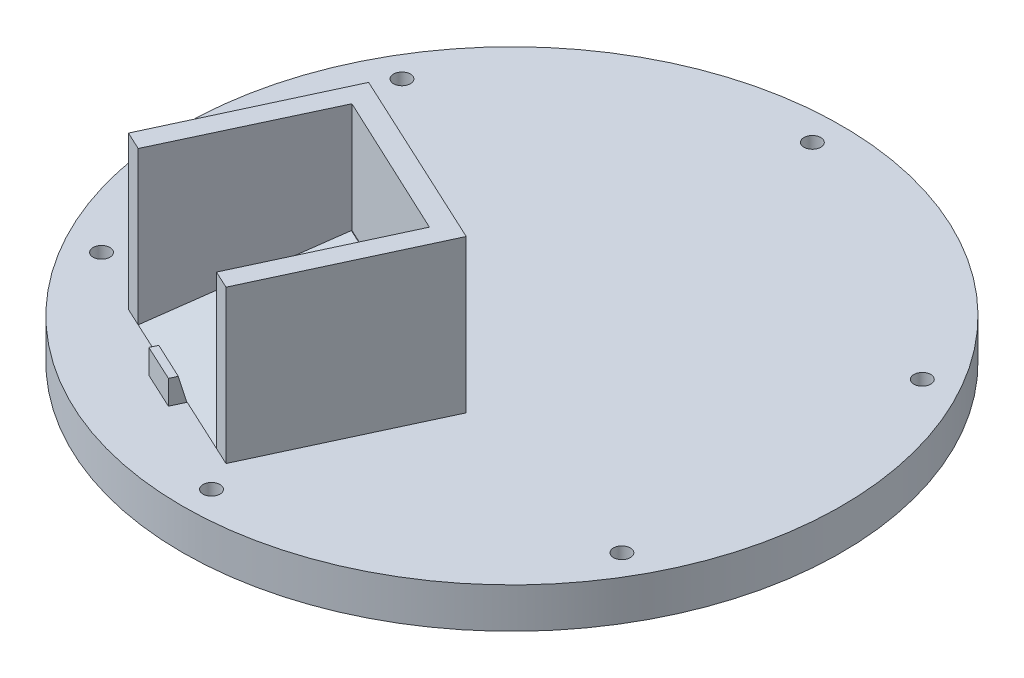
from build123d import *

# Parameters (mm, degrees)
SKETCH1_R                          = 82
BOSS_EXTRUDE5_DEPTH                = 10
TAPPED_HOLE_FOR_M4X0_7_HELICOIL4_D = 4.2
CIRPATTERN5_COUNT                  = 6
BOSS_EXTRUDE7_DEPTH                = 10.7
CUT_EXTRUDE1_DEPTH                 = 137.603415174
BOSS_EXTRUDE8_DEPTH                = 38
BOSS_EXTRUDE9_DEPTH                = 6
CUT_EXTRUDE2_DEPTH                 = 30


with BuildPart() as part:
    # Sketch1 → Boss-Extrude5 (new body)
    with BuildSketch(Plane(origin=(0, 0, 0), x_dir=(1, 0, 0), z_dir=(0, 1, 0))):
        with Locations(Location((0, 0, 0), (0, 0, 270))):
            Circle(SKETCH1_R)
    extrude(amount=BOSS_EXTRUDE5_DEPTH)

    # Tapped Hole for M4x0.7 Helicoil4 (through all)
    with Locations(Plane(origin=(0, 10, 0), x_dir=(1, 0, 0), z_dir=(0, 1, 0))):
        with Locations((0, 74.75)):
            tapped_hole_for_m4x0_7_helicoil4 = Hole(TAPPED_HOLE_FOR_M4X0_7_HELICOIL4_D / 2)

    # CirPattern5: Tapped Hole for M4x0.7 Helicoil4 ×6 about axis
    cirpattern5_axis = Axis((0, 0, 0), (0, 1, 0))
    for i in range(1, CIRPATTERN5_COUNT):
        add(tapped_hole_for_m4x0_7_helicoil4.rotate(cirpattern5_axis, i * 360 / CIRPATTERN5_COUNT), mode=Mode.SUBTRACT)

    # Sketch27 → Boss-Extrude7 (add)
    with BuildSketch(Plane(origin=(0, 10, 0), x_dir=(1, 0, 0), z_dir=(0, 1, 0))):
        Polygon((-44.554655662, -48.436893572), (-27.605576649, -12.205295199), (8.626021723, -29.154374211), (-8.181727906, -65.334302871), align=None)
    extrude(amount=BOSS_EXTRUDE7_DEPTH)

    # Sketch28 → Cut-Extrude1 (cut, through all)
    with BuildSketch(Plane(origin=(18.234649477, 0, 8.471089754), x_dir=(0.4213159772609458, 0, -0.9069139139436854), z_dir=(0.9069139139436853, 0, 0.4213159772609457))):
        Polygon((-62.69968102, 10), (-22.806226852, 20.7), (-62.69968102, 20.7), align=None)
    extrude(amount=-CUT_EXTRUDE1_DEPTH, mode=Mode.SUBTRACT)

    # Sketch14 → Boss-Extrude8 (add)
    with BuildSketch(Plane(origin=(0, 10, 0), x_dir=(1, 0, 0), z_dir=(0, 1, 0))):
        Polygon((-30.130006255, -5.519187558), (-49.089225231, -46.330313685), (-44.554655662, -48.436893572), (-27.605576649, -12.205295199), (8.626021723, -29.154374211), (-8.181727906, -65.334302871), (-3.743529534, -67.396112548), (15.215689442, -26.584986421), align=None)
    extrude(amount=BOSS_EXTRUDE8_DEPTH)

    # Sketch29 → Boss-Extrude9 (add)
    with BuildSketch(Plane(origin=(0, 10, 0), x_dir=(1, 0, 0), z_dir=(0, 1, 0))):
        Polygon((-32.365238615, -57.981021357), (-23.255343874, -62.213114555), (-21.772266919, -59.020681327), (-30.882161661, -54.788588129), align=None)
    extrude(amount=BOSS_EXTRUDE9_DEPTH)

    # Sketch31 → Cut-Extrude2 (cut)
    with BuildSketch(Plane(origin=(-17.964660281, 0, -8.403836988), x_dir=(0.42372697531108894, 0, -0.9057899593138112), z_dir=(0.9057899593138112, 0, 0.42372697531108894))):
        Polygon((-64.82666926, 17.73267596), (-62.752661337, 10), (-62.329980493, 10.1133687), (-62.276430508, 18.416684368), align=None)
    extrude(amount=CUT_EXTRUDE2_DEPTH, mode=Mode.SUBTRACT)


solid = part.part
